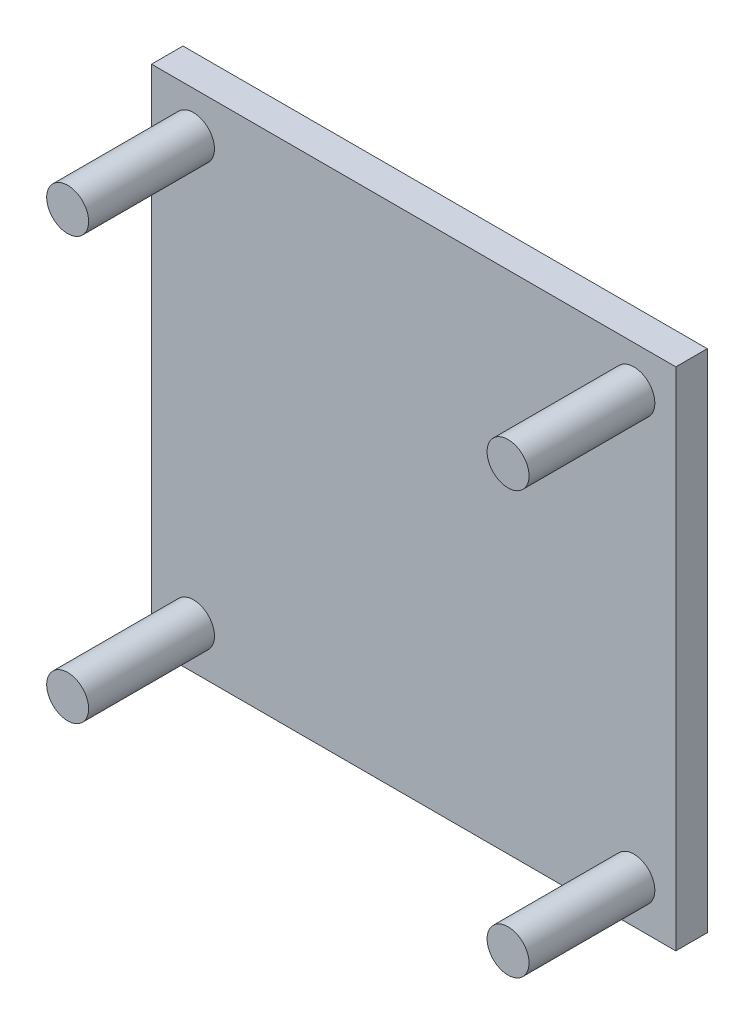
from build123d import *

# Parameters (mm, degrees)
SKETCH_1_W         = 50
SKETCH_1_H         = 48.241748444
FORMER_BASE_DEPTH  = 3
FORMER_POSTS_START = 3
SKETCH_2_R         = 2
FORMER_POSTS_DEPTH = 12


with BuildPart() as part:
    # Эскиз1 → Former_base (new body)
    with BuildSketch(Plane.XY):
        Rectangle(SKETCH_1_W, SKETCH_1_H)
    extrude(amount=FORMER_BASE_DEPTH)

    # Эскиз2 → Former_posts (add)
    with BuildSketch(Plane.XY.offset(FORMER_POSTS_START)):
        with Locations((-21, -20.120874222)):
            Circle(SKETCH_2_R)
        with Locations((-21, 20.120874222)):
            Circle(SKETCH_2_R)
        with Locations((21, -20.120874222)):
            Circle(SKETCH_2_R)
        with Locations((21, 20.120874222)):
            Circle(SKETCH_2_R)
    extrude(amount=FORMER_POSTS_DEPTH)


solid = part.part
